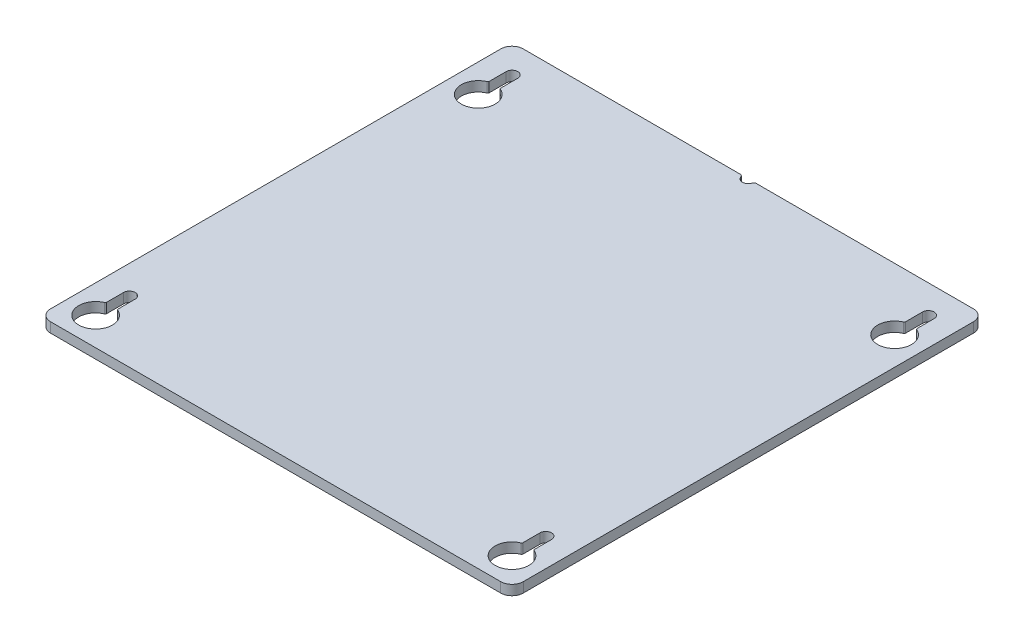
from build123d import *

# Parameters (mm, degrees)
SKETCH1_W           = 266.7
SKETCH1_H           = 266.7
SKETCH1_R           = 3.2639
BOSS_EXTRUDE1_DEPTH = 5.588
FILLET1_R           = 6.35
CUT_EXTRUDE2_DEPTH  = 378.212149518
SKETCH6_R           = 3.302
CUT_EXTRUDE3_DEPTH  = 378.212149518
FILLET2_R           = 1.5875
FILLET3_R           = 0.762


with BuildPart() as part:
    # Sketch1 → Boss-Extrude1 (new body)
    with BuildSketch(Plane(origin=(0, 0, 0), x_dir=(1, 0, 0), z_dir=(0, 1, 0))):
        with Locations((133.35, 133.35)):
            Rectangle(SKETCH1_W, SKETCH1_H)
        with Locations(Location((15.875, 250.825, 0), (0, 0, 270))):
            Circle(SKETCH1_R, mode=Mode.SUBTRACT)
        with Locations(Location((250.825, 250.825, 0), (0, 0, 270))):
            Circle(SKETCH1_R, mode=Mode.SUBTRACT)
        with Locations(Location((15.875, 15.875, 0), (0, 0, 270))):
            Circle(SKETCH1_R, mode=Mode.SUBTRACT)
        with Locations(Location((250.825, 15.875, 0), (0, 0, 270))):
            Circle(SKETCH1_R, mode=Mode.SUBTRACT)
    extrude(amount=BOSS_EXTRUDE1_DEPTH)

    # Fillet1
    fillet1_edges = [part.edges().sort_by_distance(p)[0] for p in [
        (0, 2.794, -266.7),
        (266.7, 2.794, -266.7),
        (266.7, 2.794, 0),
        (0, 2.794, 0),
    ]]
    fillet(fillet1_edges, radius=FILLET1_R)

    # Sketch5 → Cut-Extrude2 (cut, through all)
    with BuildSketch(Plane(origin=(0, 5.588, 0), x_dir=(1, 0, 0), z_dir=(0, 1, 0))):
        with BuildLine():
            Line((19.1389, 34.925), (19.1389, 24.823328436))
            ThreePointArc((19.1389, 24.823328436), (15.875, 6.35), (12.6111, 24.823328436))
            Line((12.6111, 24.823328436), (12.6111, 34.925))
            ThreePointArc((12.6111, 34.925), (15.875, 38.1889), (19.1389, 34.925))
        make_face()
        with BuildLine():
            Line((254.0889, 34.925), (254.0889, 24.823328436))
            ThreePointArc((254.0889, 24.823328436), (250.825, 6.35), (247.5611, 24.823328436))
            Line((247.5611, 24.823328436), (247.5611, 34.925))
            ThreePointArc((247.5611, 34.925), (250.825, 38.1889), (254.0889, 34.925))
        make_face()
        with BuildLine():
            Line((19.1389, 250.825), (19.1389, 240.723328436))
            ThreePointArc((19.1389, 240.723328436), (15.875, 222.25), (12.6111, 240.723328436))
            Line((12.6111, 240.723328436), (12.6111, 250.825))
            ThreePointArc((12.6111, 250.825), (15.875, 254.0889), (19.1389, 250.825))
        make_face()
        with BuildLine():
            Line((254.0889, 250.825), (254.0889, 240.723328436))
            ThreePointArc((254.0889, 240.723328436), (250.825, 222.25), (247.5611, 240.723328436))
            Line((247.5611, 240.723328436), (247.5611, 250.825))
            ThreePointArc((247.5611, 250.825), (250.825, 254.0889), (254.0889, 250.825))
        make_face()
    extrude(amount=-CUT_EXTRUDE2_DEPTH, mode=Mode.SUBTRACT)

    # Sketch6 → Cut-Extrude3 (cut, through all)
    with BuildSketch(Plane(origin=(0, 5.588, 0), x_dir=(1, 0, 0), z_dir=(0, 1, 0))):
        with Locations((133.35, 266.7)):
            Circle(SKETCH6_R)
    extrude(amount=-CUT_EXTRUDE3_DEPTH, mode=Mode.SUBTRACT)

    # Fillet2
    fillet2_edges = [part.edges().sort_by_distance(p)[0] for p in [
        (130.048, 2.794, -266.7),
        (136.652, 2.794, -266.7),
    ]]
    fillet(fillet2_edges, radius=FILLET2_R)

    # Fillet3
    fillet3_edges = [part.edges().sort_by_distance(p)[0] for p in [
        (254.0889, 2.794, -24.823328436),
        (247.5611, 2.794, -24.823328436),
        (19.1389, 2.794, -240.723328436),
        (12.6111, 2.794, -240.723328436),
        (254.0889, 2.794, -240.723328436),
        (247.5611, 2.794, -240.723328436),
        (19.1389, 2.794, -24.823328436),
        (12.6111, 2.794, -24.823328436),
    ]]
    fillet(fillet3_edges, radius=FILLET3_R)


solid = part.part
